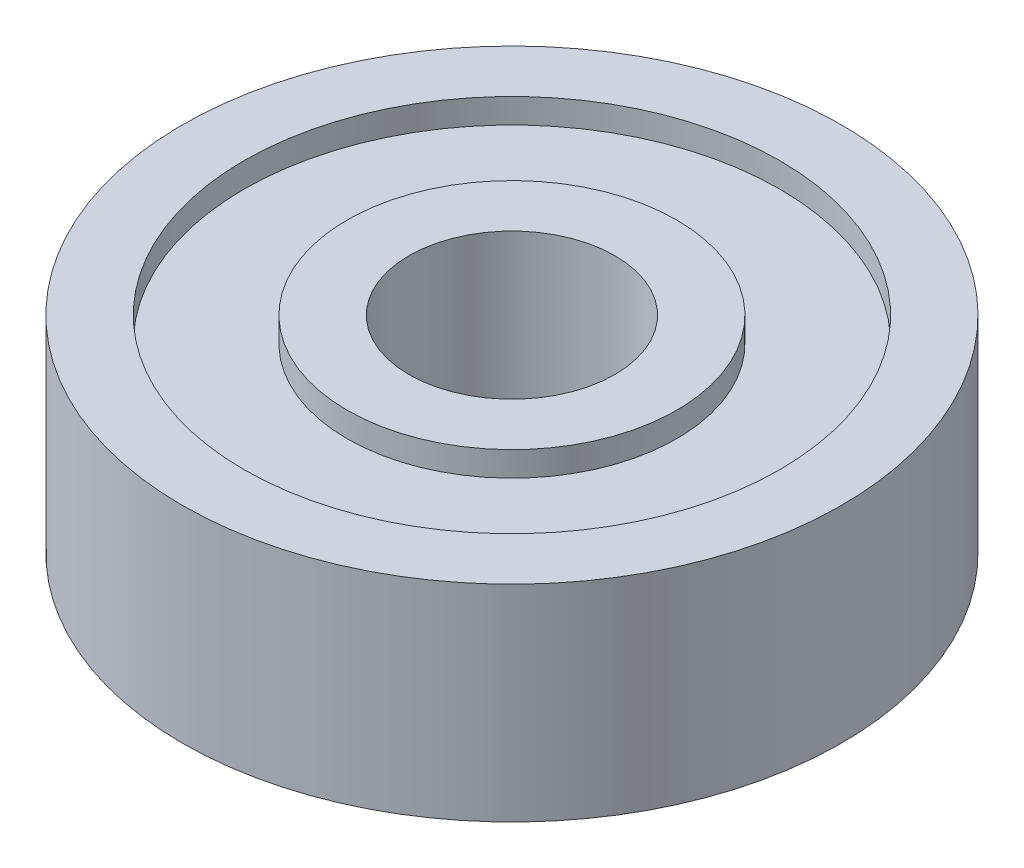
from build123d import *

# Parameters (mm, degrees)
SKETCH1_R           = 8
SKETCH1_R_2         = 2.5
BOSS_EXTRUDE1_DEPTH = 5
SKETCH2_R           = 6.5
SKETCH2_R_2         = 4
CUT_EXTRUDE1_DEPTH  = 0.6
CUT_EXTRUDE2_START  = -0.6
SKETCH3_R           = 6.5
SKETCH3_R_2         = 4
CUT_EXTRUDE2_DEPTH  = 0.6


with BuildPart() as part:
    # Sketch1 → Boss-Extrude1 (new body)
    with BuildSketch(Plane(origin=(0, 0, 0), x_dir=(1, 0, 0), z_dir=(0, 1, 0))):
        with Locations(Location((0, 0, 0), (0, 0, 270))):
            Circle(SKETCH1_R)
        with Locations(Location((0, 0, 0), (0, 0, 270))):
            Circle(SKETCH1_R_2, mode=Mode.SUBTRACT)
    extrude(amount=BOSS_EXTRUDE1_DEPTH)

    # Sketch2 → Cut-Extrude1 (cut)
    with BuildSketch(Plane(origin=(0, 5, 0), x_dir=(1, 0, 0), z_dir=(0, 1, 0))):
        with Locations(Location((0, 0, 0), (0, 0, 270))):
            Circle(SKETCH2_R)
        with Locations(Location((0, 0, 0), (0, 0, 270))):
            Circle(SKETCH2_R_2, mode=Mode.SUBTRACT)
    extrude(amount=-CUT_EXTRUDE1_DEPTH, mode=Mode.SUBTRACT)

    # Sketch3 → Cut-Extrude2 (cut)
    with BuildSketch(Plane.XZ.offset(CUT_EXTRUDE2_START)):
        with Locations(Location((0, 0, 0), (0, 0, 90))):
            Circle(SKETCH3_R)
        with Locations(Location((0, 0, 0), (0, 0, 90))):
            Circle(SKETCH3_R_2, mode=Mode.SUBTRACT)
    extrude(amount=CUT_EXTRUDE2_DEPTH, mode=Mode.SUBTRACT)


solid = part.part
